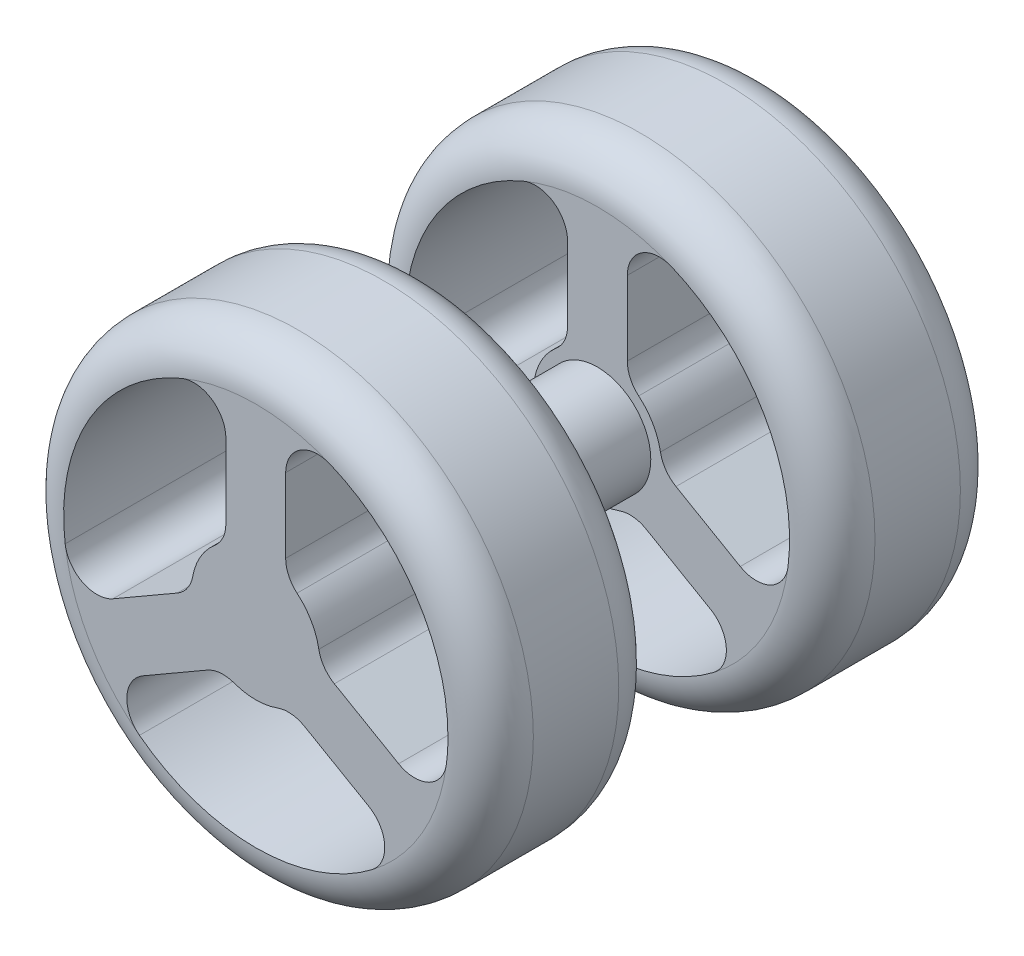
from build123d import *

# Parameters (mm, degrees)
SKETCH1_R           = 27.94
BOSS_EXTRUDE1_DEPTH = 20.32
SKETCH2_R           = 6.35
BOSS_EXTRUDE2_DEPTH = 20.32
BOSS_EXTRUDE3_START = 20.32
SKETCH3_R           = 27.94
BOSS_EXTRUDE3_DEPTH = 20.32
FILLET1_R           = 5.08
FILLET2_R           = 5.08
FILLET3_R           = 5.08
FILLET4_R           = 5.08
CUT_EXTRUDE1_DEPTH  = 73.645776241


with BuildPart() as part:
    # Sketch1 → Boss-Extrude1 (new body)
    with BuildSketch(Plane.XY):
        Circle(SKETCH1_R)
    extrude(amount=BOSS_EXTRUDE1_DEPTH)

    # Sketch2 → Boss-Extrude2 (add)
    with BuildSketch(Plane(origin=(0, 0, 0), x_dir=(-1, 0, 0), z_dir=(0, 0, -1))):
        with Locations(Location((0, 0, 0), (0, 0, 180))):
            Circle(SKETCH2_R)
    extrude(amount=BOSS_EXTRUDE2_DEPTH)

    # Sketch3 → Boss-Extrude3 (add)
    with BuildSketch(Plane(origin=(0, 0, -20.32), x_dir=(-1, 0, 0), z_dir=(0, 0, -1)).offset(BOSS_EXTRUDE3_START)):
        with Locations(Location((0, 0, 0), (0, 0, 180))):
            Circle(SKETCH3_R)
    extrude(amount=-BOSS_EXTRUDE3_DEPTH)

    # Fillet1
    fillet1_edges = [part.edges().sort_by_distance(p)[0] for p in [
        (-27.94, 0, 20.32),
    ]]
    fillet(fillet1_edges, radius=FILLET1_R)

    # Fillet2
    fillet2_edges = [part.edges().sort_by_distance(p)[0] for p in [
        (-27.94, 0, 0),
    ]]
    fillet(fillet2_edges, radius=FILLET2_R)

    # Fillet3
    fillet3_edges = [part.edges().sort_by_distance(p)[0] for p in [
        (-27.94, 0, -20.32),
    ]]
    fillet(fillet3_edges, radius=FILLET3_R)

    # Fillet4
    fillet4_edges = [part.edges().sort_by_distance(p)[0] for p in [
        (-27.94, 0, -40.64),
    ]]
    fillet(fillet4_edges, radius=FILLET4_R)

    # Sketch4 → Cut-Extrude1 (cut, through all)
    with BuildSketch(Plane(origin=(0, 0, -40.64), x_dir=(-1, 0, 0), z_dir=(0, 0, -1))):
        with BuildLine():
            Line((-3.556, 8.739962471), (-3.556, 17.568282329))
            ThreePointArc((-3.556, 17.568282329), (-5.256117539, 20.740741312), (-8.8392, 21.081938795))
            ThreePointArc((-8.8392, 21.081938795), (-19.797340731, 11.43), (-22.677094558, -2.885997648))
            ThreePointArc((-22.677094558, -2.885997648), (-20.590067639, -5.818439342), (-16.992578798, -5.704554829))
            Line((-16.992578798, -5.704554829), (-9.347029528, -1.2903949))
            ThreePointArc((-9.347029528, -1.2903949), (-8.133427478, -0.179541209), (-7.501353019, 1.339441259))
            ThreePointArc((-7.501353019, 1.339441259), (-6.599113577, 3.81), (-4.910666667, 5.826641648))
            ThreePointArc((-4.910666667, 5.826641648), (-3.911226491, 7.13352542), (-3.556, 8.739962471))
        make_face()
        with BuildLine():
            Line((3.556, 8.739962471), (3.556, 17.568282329))
            ThreePointArc((3.556, 17.568282329), (5.256117539, 20.740741312), (8.8392, 21.081938795))
            ThreePointArc((8.8392, 21.081938795), (19.797340731, 11.43), (22.677094558, -2.885997648))
            ThreePointArc((22.677094558, -2.885997648), (20.590067639, -5.818439342), (16.992578798, -5.704554829))
            Line((16.992578798, -5.704554829), (9.347029528, -1.2903949))
            ThreePointArc((9.347029528, -1.2903949), (8.133427478, -0.179541209), (7.501353019, 1.339441259))
            ThreePointArc((7.501353019, 1.339441259), (6.599113577, 3.81), (4.910666667, 5.826641648))
            ThreePointArc((4.910666667, 5.826641648), (3.911226491, 7.13352542), (3.556, 8.739962471))
        make_face()
        with BuildLine():
            Line((5.791029528, -7.449567572), (13.436578798, -11.8637275))
            ThreePointArc((13.436578798, -11.8637275), (15.3339501, -14.92230197), (13.837894558, -18.195941147))
            ThreePointArc((13.837894558, -18.195941147), (0, -22.86), (-13.837894558, -18.195941147))
            ThreePointArc((-13.837894558, -18.195941147), (-15.3339501, -14.92230197), (-13.436578798, -11.8637275))
            Line((-13.436578798, -11.8637275), (-5.791029528, -7.449567572))
            ThreePointArc((-5.791029528, -7.449567572), (-4.222200987, -6.953984211), (-2.590686352, -7.166082907))
            ThreePointArc((-2.590686352, -7.166082907), (0, -7.62), (2.590686352, -7.166082907))
            ThreePointArc((2.590686352, -7.166082907), (4.222200987, -6.953984211), (5.791029528, -7.449567572))
        make_face()
    extrude(amount=-CUT_EXTRUDE1_DEPTH, mode=Mode.SUBTRACT)


solid = part.part
